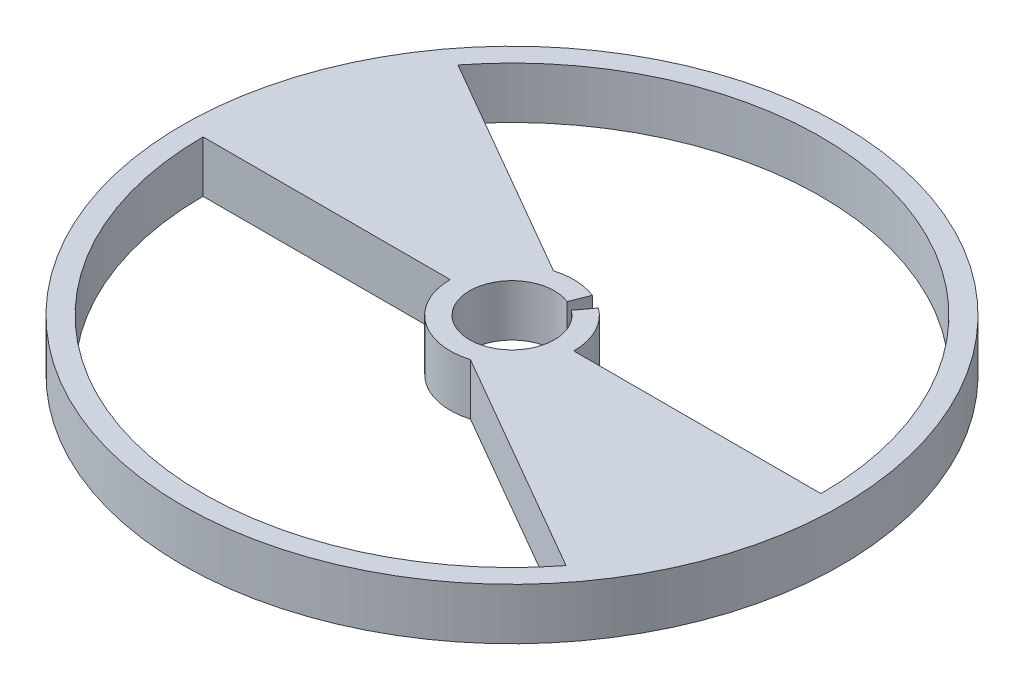
from build123d import *

# Parameters (mm, degrees)
SKETCH1_R           = 16
SKETCH1_R_2         = 2.06
BOSS_EXTRUDE1_DEPTH = 2.5
CUT_EXTRUDE1_DEPTH  = 23.765104876


with BuildPart() as part:
    # Sketch1 → Boss-Extrude1 (new body)
    with BuildSketch(Plane(origin=(0, 0, 0), x_dir=(1, 0, 0), z_dir=(0, 1, 0))):
        with Locations(Location((0, 0, 0), (0, 0, 270))):
            Circle(SKETCH1_R)
        with Locations(Location((0, 0, 0), (0, 0, 270))):
            Circle(SKETCH1_R_2, mode=Mode.SUBTRACT)
        with BuildLine():
            Line((-3, 0), (-15, 0))
            ThreePointArc((-15, 0), (-4.8703472, -14.187308348), (11.837295753, -9.212948999))
            Line((11.837295753, -9.212948999), (0.858729732, -2.874470951))
            ThreePointArc((0.858729732, -2.874470951), (-1.792178954, -2.405845921), (-3, 0))
        make_face(mode=Mode.SUBTRACT)
        with BuildLine():
            Line((-11.837295753, 9.212948999), (-0.858729732, 2.874470951))
            ThreePointArc((-0.858729732, 2.874470951), (1.792178954, 2.405845921), (3, 0))
            Line((3, 0), (15, 0))
            ThreePointArc((15, 0), (4.8703472, 14.187308348), (-11.837295753, 9.212948999))
        make_face(mode=Mode.SUBTRACT)
    extrude(amount=BOSS_EXTRUDE1_DEPTH)

    # Sketch2 → Cut-Extrude1 (cut, through all)
    with BuildSketch(Plane(origin=(0, 2.5, 0), x_dir=(1, 0, 0), z_dir=(0, 1, 0))):
        with BuildLine():
            Line((1.108433193, 2.787718755), (0.761124126, 1.914233545))
            ThreePointArc((0.761124126, 1.914233545), (1.004470219, 1.798510378), (1.230629548, 1.652014199))
            Line((1.230629548, 1.652014199), (1.792178954, 2.405845921))
            ThreePointArc((1.792178954, 2.405845921), (1.462820707, 2.619189871), (1.108433193, 2.787718755))
        make_face()
    extrude(amount=-CUT_EXTRUDE1_DEPTH, mode=Mode.SUBTRACT)


solid = part.part
